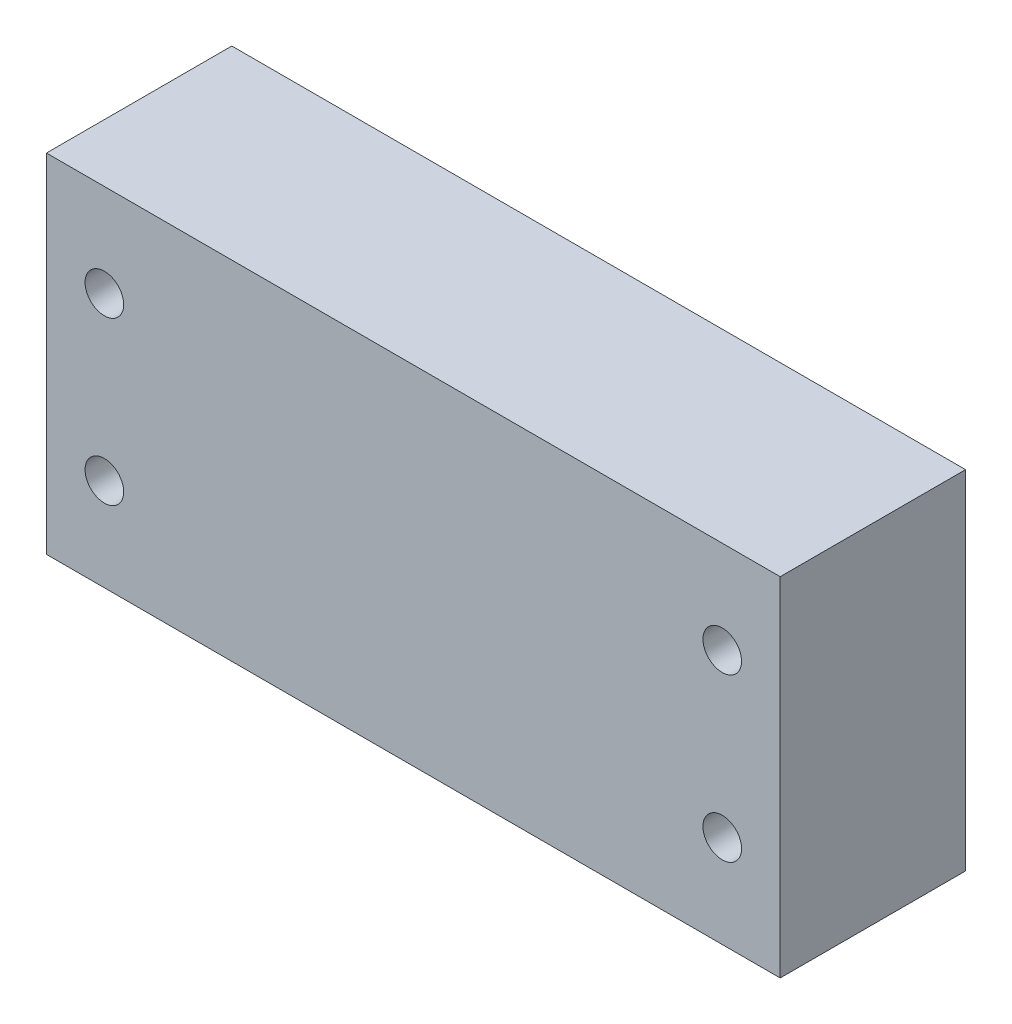
from build123d import *

# Parameters (mm, degrees)
SKETCH1_W           = 95
SKETCH1_H           = 45
BOSS_EXTRUDE1_DEPTH = 24
SKETCH2_R           = 2.5
CUT_EXTRUDE1_DEPTH  = 58.77975424


with BuildPart() as part:
    # Sketch1 → Boss-Extrude1 (new body)
    with BuildSketch(Plane.XY):
        Rectangle(SKETCH1_W, SKETCH1_H)
    extrude(amount=BOSS_EXTRUDE1_DEPTH)

    # Sketch2 → Cut-Extrude1 (cut, through all)
    with BuildSketch(Plane.XY.offset(24)):
        with Locations((-40, 10.5)):
            Circle(SKETCH2_R)
        with Locations((-40, -10.5)):
            Circle(SKETCH2_R)
        with Locations((40, -10.5)):
            Circle(SKETCH2_R)
        with Locations((40, 10.5)):
            Circle(SKETCH2_R)
    extrude(amount=-CUT_EXTRUDE1_DEPTH, mode=Mode.SUBTRACT)


solid = part.part
